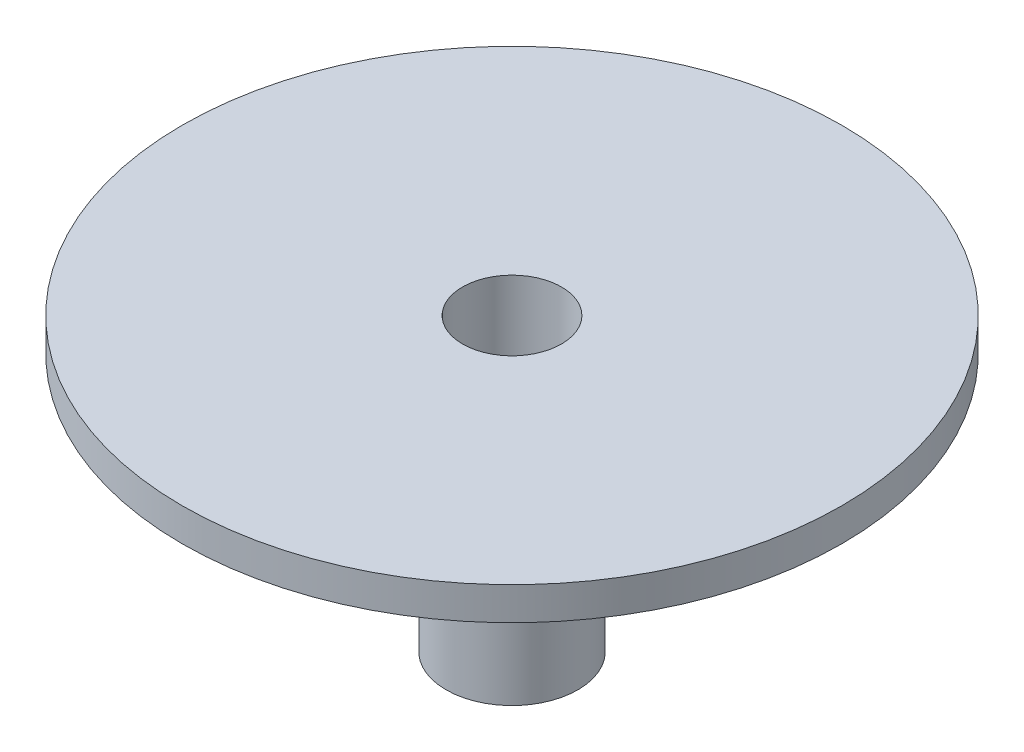
from build123d import *


with BuildPart() as part:
    # Sketch1 → Revolve1 (revolve)
    with BuildSketch(Plane(origin=(0, 0, 0), x_dir=(0, 0, -1), z_dir=(1, 0, 0))):
        Polygon((-7.5, -2.75), (-7.5, 10.25), (-30, 10.25), (-30, 13.25), (-4.5, 13.25), (-4.5, -13.25), (-6, -13.25), (-6, -2.75), align=None)
    revolve(axis=Axis((0, 33.12780523, 0), (0, -1, 0)))


solid = part.part
